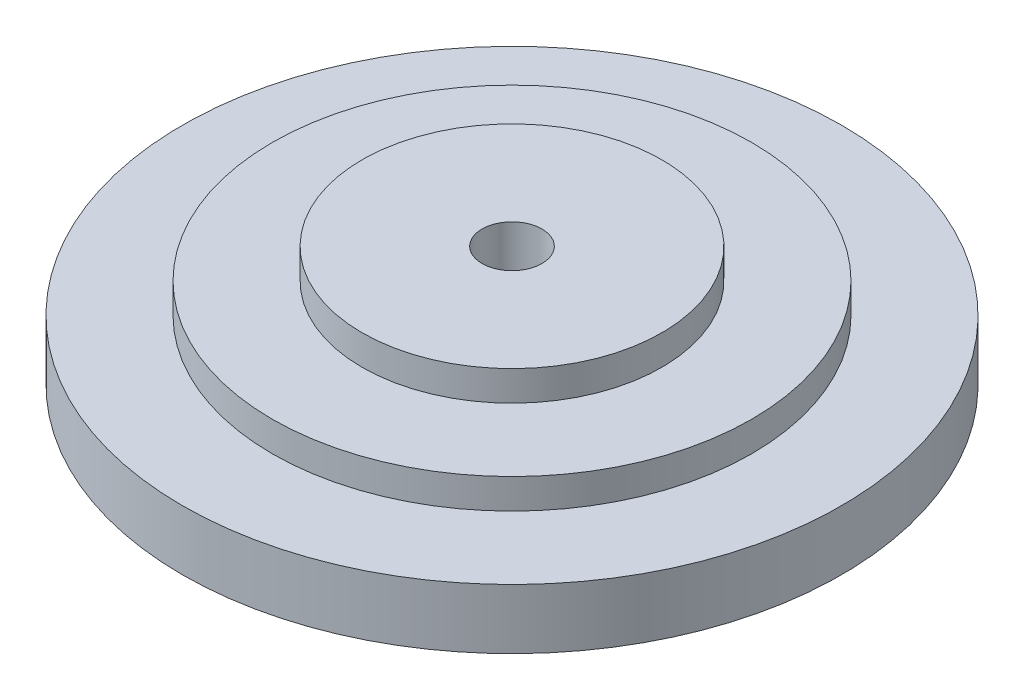
from build123d import *

# Parameters (mm, degrees)
SCHIZZO2_R                   = 55.0225
SCHIZZO2_R_2                 = 40.0225
ESTRUSIONE_ESTRUSIONE1_DEPTH = 10
SCHIZZO2_3_R                 = 40.0225
SCHIZZO2_3_R_2               = 25.0225
ESTRUSIONE_ESTRUSIONE2_DEPTH = 15
SCHIZZO2_4_R                 = 25.0225
SCHIZZO2_4_R_2               = 5
ESTRUSIONE_ESTRUSIONE3_DEPTH = 20


with BuildPart() as part:
    # Schizzo2 → Estrusione-Estrusione1 (new body)
    with BuildSketch(Plane(origin=(0, 0, 0), x_dir=(1, 0, 0), z_dir=(0, 1, 0))):
        Circle(SCHIZZO2_R)
        Circle(SCHIZZO2_R_2, mode=Mode.SUBTRACT)
    extrude(amount=ESTRUSIONE_ESTRUSIONE1_DEPTH)

    # Schizzo2<3> → Estrusione-Estrusione2 (add)
    with BuildSketch(Plane(origin=(0, 0, 0), x_dir=(1, 0, 0), z_dir=(0, 1, 0))):
        Circle(SCHIZZO2_3_R)
        Circle(SCHIZZO2_3_R_2, mode=Mode.SUBTRACT)
    extrude(amount=ESTRUSIONE_ESTRUSIONE2_DEPTH)

    # Schizzo2<4> → Estrusione-Estrusione3 (add)
    with BuildSketch(Plane(origin=(0, 0, 0), x_dir=(1, 0, 0), z_dir=(0, 1, 0))):
        Circle(SCHIZZO2_4_R)
        Circle(SCHIZZO2_4_R_2, mode=Mode.SUBTRACT)
    extrude(amount=ESTRUSIONE_ESTRUSIONE3_DEPTH)


solid = part.part
